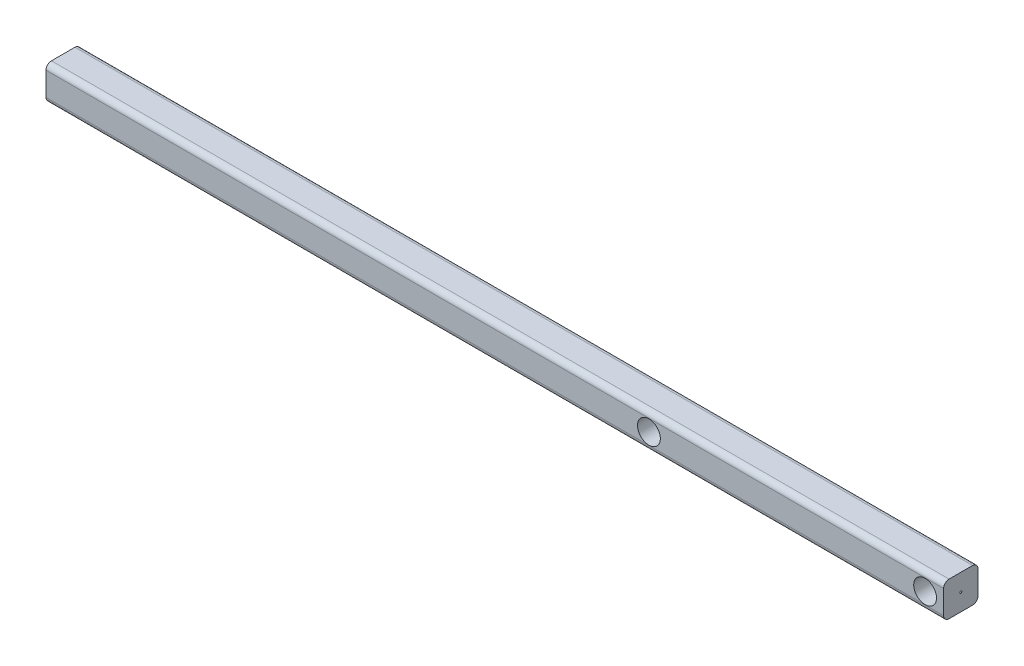
from build123d import *

# Parameters (mm, degrees)
SKETCH_1_W          = 6.32
SKETCH_1_H          = 6.32
SKETCH_1_R          = 0.1861223
EXTRUDE_1_DEPTH     = 165.1
FILLET_1_R          = 1
SKETCH_2_R          = 2.1
CUT_EXTRUDE_1_DEPTH = 165.1


with BuildPart() as part:
    # 草图1 → 凸台-拉伸1 (new body)
    with BuildSketch(Plane(origin=(0, 0, 0), x_dir=(0, 0, -1), z_dir=(1, 0, 0))):
        Rectangle(SKETCH_1_W, SKETCH_1_H)
        Circle(SKETCH_1_R, mode=Mode.SUBTRACT)
    extrude(amount=EXTRUDE_1_DEPTH)

    # 圆角1
    fillet_1_edges = [part.edges().sort_by_distance(p)[0] for p in [
        (82.55, -3.16, -3.16),
        (82.55, -3.16, 3.16),
        (82.55, 3.16, 3.16),
        (82.55, 3.16, -3.16),
    ]]
    fillet(fillet_1_edges, radius=FILLET_1_R)

    # 草图2 → 切除-拉伸1 (cut)
    with BuildSketch(Plane(origin=(0, 0, -3.16), x_dir=(-1, 0, 0), z_dir=(0, 0, -1))):
        with Locations((-161.692066873, -0.018189101)):
            Circle(SKETCH_2_R)
        with Locations((-110.892066873, -0.018189101)):
            Circle(SKETCH_2_R)
    extrude(amount=-CUT_EXTRUDE_1_DEPTH, mode=Mode.SUBTRACT)


solid = part.part
